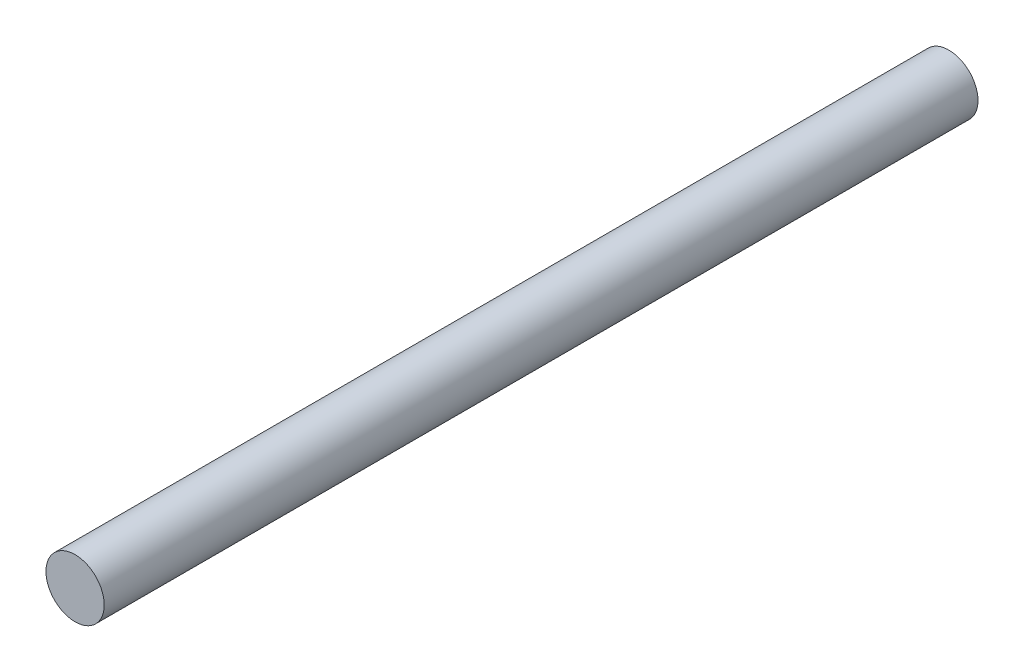
from build123d import *

# Parameters (mm, degrees)
SKETCH1_R           = 3
BOSS_EXTRUDE1_DEPTH = 90


with BuildPart() as part:
    # Sketch1 → Boss-Extrude1 (new body)
    with BuildSketch(Plane.XY):
        Circle(SKETCH1_R)
    extrude(amount=BOSS_EXTRUDE1_DEPTH)


solid = part.part
